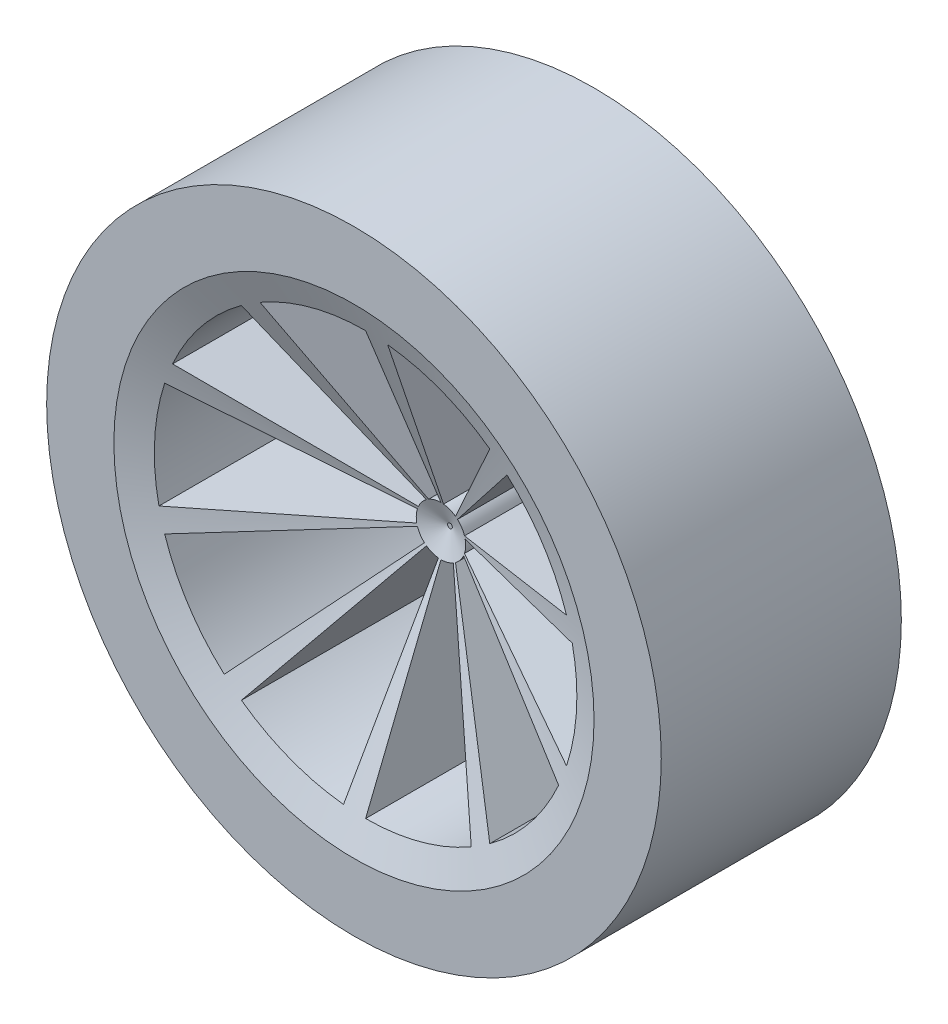
from build123d import *

# Parameters (mm, degrees)
SKETCH_1_R          = 32
EXTRUDE_1_DEPTH     = 25
SKETCH_2_R          = 25
CUT_EXTRUDE_1_DEPTH = 10
CUT_EXTRUDE_1_TAPER = 68
CUT_EXTRUDE_6_DEPTH = 50


with BuildPart() as part:
    # 스케치1 → 보스-돌출1 (new body)
    with BuildSketch(Plane.XY):
        Circle(SKETCH_1_R)
    extrude(amount=EXTRUDE_1_DEPTH)

    # 스케치2 → 컷-돌출1 (cut)
    with BuildSketch(Plane.XY.offset(25)):
        Circle(SKETCH_2_R)
    extrude(amount=-CUT_EXTRUDE_1_DEPTH, taper=CUT_EXTRUDE_1_TAPER, mode=Mode.SUBTRACT)

    # 스케치4 → 컷-돌출6 (cut)
    with BuildSketch(Plane(origin=(0, 0, 0), x_dir=(-1, 0, 0), z_dir=(0, 0, -1))):
        with BuildLine():
            Line((0, 22), (0, 2.575144905))
            ThreePointArc((0, 2.575144905), (0.666496545, 2.48739897), (1.287572453, 2.230140906))
            Line((1.287572453, 2.230140906), (11, 19.052558883))
            ThreePointArc((11, 19.052558883), (5.694018992, 21.250368178), (0, 22))
        make_face()
        with BuildLine():
            Line((20.098000068, 8.948206148), (2.352511931, 1.047405794))
            ThreePointArc((2.352511931, 1.047405794), (2.001263463, 1.620591199), (1.513632198, 2.083335991))
            Line((1.513632198, 2.083335991), (12.93127555, 17.798373876))
            ThreePointArc((12.93127555, 17.798373876), (17.097211152, 13.845048603), (20.098000068, 8.948206148))
        make_face()
        with BuildLine():
            Line((21.519247216, -4.574057198), (2.51887181, -0.535402731))
            ThreePointArc((2.51887181, -0.535402731), (2.571615758, 0.134772671), (2.449108342, 0.795763539))
            Line((2.449108342, 0.795763539), (20.923243358, 6.798373876))
            ThreePointArc((20.923243358, 6.798373876), (21.969849765, 1.151391037), (21.519247216, -4.574057198))
        make_face()
        with BuildLine():
            Line((14.72087334, -16.349186161), (1.723108272, -1.913705611))
            ThreePointArc((1.723108272, -1.913705611), (2.15969824, -1.402524436), (2.449108342, -0.795763539))
            Line((2.449108342, -0.795763539), (20.923243358, -6.798373876))
            ThreePointArc((20.923243358, -6.798373876), (18.450752495, -11.98205877), (14.72087334, -16.349186161))
        make_face()
        with BuildLine():
            Line((2.299626192, -21.879481698), (0.26917594, -2.561037992))
            ThreePointArc((0.26917594, -2.561037992), (0.922849399, -2.404104879), (1.513632198, -2.083335991))
            Line((1.513632198, -2.083335991), (12.93127555, -17.798373876))
            ThreePointArc((12.93127555, -17.798373876), (7.88409489, -20.538769383), (2.299626192, -21.879481698))
        make_face()
        with BuildLine():
            Line((-11, -19.052558883), (-1.287572453, -2.230140906))
            ThreePointArc((-1.287572453, -2.230140906), (-0.666496545, -2.48739897), (0, -2.575144905))
            Line((0, -2.575144905), (0, -22))
            ThreePointArc((0, -22), (-5.694018992, -21.250368178), (-11, -19.052558883))
        make_face()
        with BuildLine():
            Line((-20.098000068, -8.948206148), (-2.352511931, -1.047405794))
            ThreePointArc((-2.352511931, -1.047405794), (-2.001263463, -1.620591199), (-1.513632198, -2.083335991))
            Line((-1.513632198, -2.083335991), (-12.93127555, -17.798373876))
            ThreePointArc((-12.93127555, -17.798373876), (-17.097211152, -13.845048603), (-20.098000068, -8.948206148))
        make_face()
        with BuildLine():
            Line((-21.519247216, 4.574057198), (-2.51887181, 0.535402731))
            ThreePointArc((-2.51887181, 0.535402731), (-2.571615758, -0.134772671), (-2.449108342, -0.795763539))
            Line((-2.449108342, -0.795763539), (-20.923243358, -6.798373876))
            ThreePointArc((-20.923243358, -6.798373876), (-21.969849765, -1.151391037), (-21.519247216, 4.574057198))
        make_face()
        with BuildLine():
            Line((-14.72087334, 16.349186161), (-1.723108272, 1.913705611))
            ThreePointArc((-1.723108272, 1.913705611), (-2.15969824, 1.402524436), (-2.449108342, 0.795763539))
            Line((-2.449108342, 0.795763539), (-20.923243358, 6.798373876))
            ThreePointArc((-20.923243358, 6.798373876), (-18.450752495, 11.98205877), (-14.72087334, 16.349186161))
        make_face()
        with BuildLine():
            Line((-2.299626192, 21.879481698), (-0.26917594, 2.561037992))
            ThreePointArc((-0.26917594, 2.561037992), (-0.922849399, 2.404104879), (-1.513632198, 2.083335991))
            Line((-1.513632198, 2.083335991), (-12.93127555, 17.798373876))
            ThreePointArc((-12.93127555, 17.798373876), (-7.88409489, 20.538769383), (-2.299626192, 21.879481698))
        make_face()
    extrude(amount=-CUT_EXTRUDE_6_DEPTH, mode=Mode.SUBTRACT)


solid = part.part
